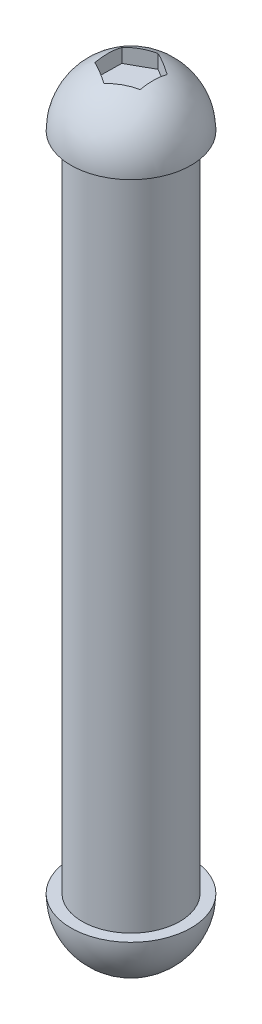
from build123d import *

# Parameters (mm, degrees)
REVOLVE_1_ANGLE     = 180
CUT_EXTRUDE_1_DEPTH = 1
SKETCH_3_R          = 2.44
EXTRUDE_1_DEPTH     = 16.5


with BuildPart() as part:
    # 草图1 → 旋转1 (revolve)
    with BuildSketch(Plane(origin=(0, 0, 0), x_dir=(1, 0, 0), z_dir=(0, 1, 0))):
        with BuildLine():
            Line((-0.227216636, -2.991383058), (0.227216636, 2.991383058))
            ThreePointArc((0.227216636, 2.991383058), (-2.991383058, 0.227216636), (-0.227216636, -2.991383058))
        make_face()
    revolve(axis=Axis((0.227216636, 0, -2.991383058), (-0.07573887865673318, 0, 0.9971276860361569)), revolution_arc=REVOLVE_1_ANGLE)

    # 草图2 → 切除-拉伸1 (cut)
    with BuildSketch(Plane(origin=(0, -3, 0), x_dir=(-1, 0, 0), z_dir=(0, -1, 0))):
        Polygon((1.161360834, -0.646595492), (1.140648539, 0.68247024), (-0.020712296, 1.329065731), (-1.161360834, 0.646595492), (-1.140648539, -0.68247024), (0.020712296, -1.329065731), align=None)
    extrude(amount=-CUT_EXTRUDE_1_DEPTH, mode=Mode.SUBTRACT)

    # 草图3 → 凸台-拉伸1 (add)
    with BuildSketch(Plane(origin=(0, 0, 0), x_dir=(1, 0, 0), z_dir=(0, 1, 0))):
        Circle(SKETCH_3_R)
    extrude(amount=EXTRUDE_1_DEPTH)

    # 镜向1: part across plane


with BuildPart() as part_1:
    add(part.part)
    add(part.part.mirror(Plane.ZX.offset(16.5)))


solid = part_1.part
